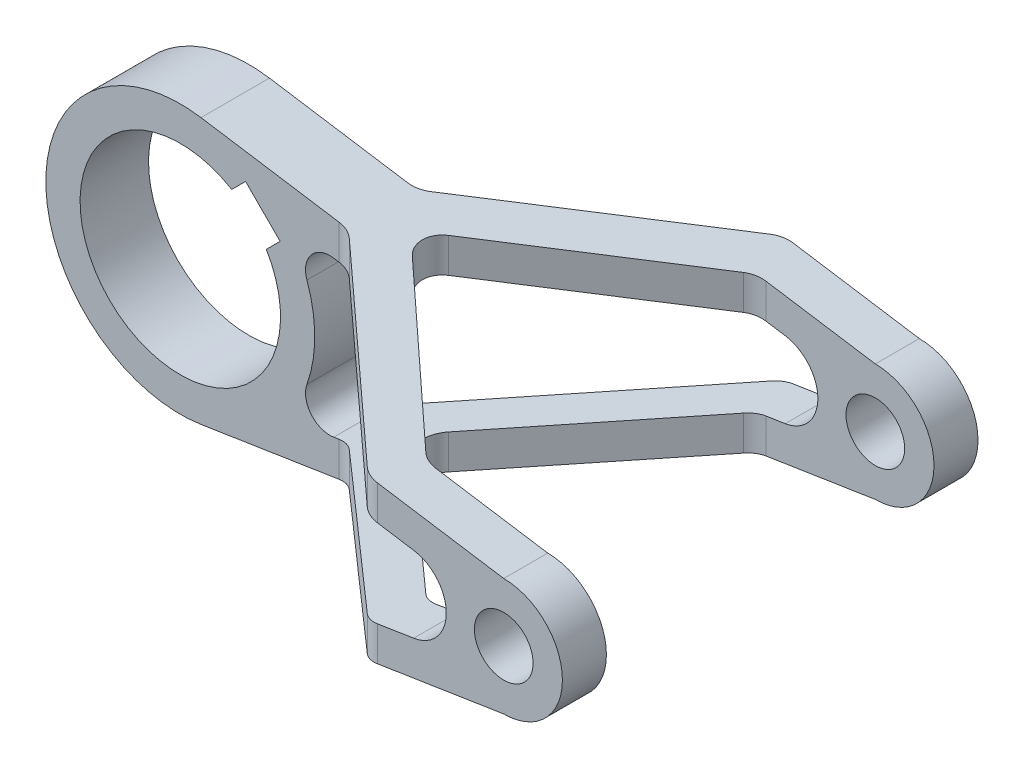
from build123d import *

# Parameters (mm, degrees)
Y_KSEKLIK_EKSTR_ZYON1_DEPTH = 55
KES_EKSTR_ZYON1_DEPTH       = 55
KES_EKSTR_ZYON1_DEPTH_BACK  = 55
IZIM4_R                     = 20.5
IZIM4_R_2                   = 6
KES_EKSTR_ZYON2_DEPTH       = 55
KES_EKSTR_ZYON2_DEPTH_BACK  = 55
KES_EKSTR_ZYON3_DEPTH       = 107.314994316
KES_EKSTR_ZYON3_DEPTH_BACK  = 107.314994316


with BuildPart() as part:
    # Çizim2 → Yükseklik-Ekstrüzyon1 (new body)
    with BuildSketch(Plane(origin=(0, 0, 0), x_dir=(1, 0, 0), z_dir=(0, 1, 0))):
        with BuildLine():
            Line((-60.70745329, -7), (-0.70745329, -7))
            ThreePointArc((-0.70745329, -7), (1.083042474, -7.331582183), (2.636059642, -8.282350033))
            Line((2.636059642, -8.282350033), (39.256799322, -41.217649967))
            ThreePointArc((39.256799322, -41.217649967), (40.809816489, -42.168417817), (42.600312254, -42.5))
            Line((42.600312254, -42.5), (80.446429482, -42.5))
            Line((80.446429482, -42.5), (80.446429482, -33.5))
            Line((80.446429482, -33.5), (45.577301243, -33.5))
            ThreePointArc((45.577301243, -33.5), (43.771367773, -33.162467619), (42.209258712, -32.19544172))
            Line((42.209258712, -32.19544172), (10.967785126, -3.72181941))
            ThreePointArc((10.967785126, -3.72181941), (9.335858983, -0.008678576), (10.994031787, 3.692815818))
            Line((10.994031787, 3.692815818), (42.741966981, 32.219193509))
            ThreePointArc((42.741966981, 32.219193509), (44.294345006, 33.168831093), (46.083762852, 33.5))
            Line((46.083762852, 33.5), (80.446429482, 33.5))
            Line((80.446429482, 33.5), (80.446429482, 42.5))
            Line((80.446429482, 42.5), (42.634342581, 42.5))
            ThreePointArc((42.634342581, 42.5), (40.844924735, 42.168831093), (39.29254671, 41.219193509))
            Line((39.29254671, 41.219193509), (2.634342581, 8.280806491))
            ThreePointArc((2.634342581, 8.280806491), (1.081964556, 7.331168907), (-0.70745329, 7))
            Line((-0.70745329, 7), (-60.70745329, 7))
            Line((-60.70745329, 7), (-60.70745329, -7))
        make_face()
    extrude(amount=Y_KSEKLIK_EKSTR_ZYON1_DEPTH)

    # Çizim4 → Kes-Ekstrüzyon1 (cut, two sides: drawn at the far end of the back side and taken through both)
    with BuildSketch(Plane.XY.offset(-KES_EKSTR_ZYON1_DEPTH_BACK)):
        with BuildLine():
            Line((-28.975635888, 54.672444157), (68.446429482, 39.5))
            ThreePointArc((68.446429482, 39.5), (76.931710856, 35.985281374), (80.446429482, 27.5))
            Line((80.446429482, 27.5), (80.446429482, 55))
            Line((80.446429482, 55), (-33.207453133, 55))
            ThreePointArc((-33.207453133, 55), (-31.085215516, 54.917988745), (-28.975635888, 54.672444157))
        make_face()
        with BuildLine():
            Line((80.446429482, 0), (80.446429482, 27.5))
            ThreePointArc((80.446429482, 27.5), (76.931710856, 19.014718626), (68.446429482, 15.5))
            Line((68.446429482, 15.5), (-28.975635888, 0.327555843))
            ThreePointArc((-28.975635888, 0.327555843), (-31.085215594, 0.082011249), (-33.20745329, 0))
            Line((-33.20745329, 0), (80.446429482, 0))
        make_face()
        with BuildLine():
            ThreePointArc((-60.70745329, 27.5), (-52.652889717, 46.945436538), (-33.207453133, 55))
            Line((-33.207453133, 55), (-60.70745329, 55))
            Line((-60.70745329, 55), (-60.70745329, 27.5))
        make_face()
        with BuildLine():
            ThreePointArc((-33.20745329, 0), (-52.652889773, 8.054563517), (-60.70745329, 27.5))
            Line((-60.70745329, 27.5), (-60.70745329, 0))
            Line((-60.70745329, 0), (-33.20745329, 0))
        make_face()
        with Locations(Location((-33.20745329, 27.5, 0), (0, 0, 180))):
            Circle(IZIM4_R)
        with Locations(Location((68.446429482, 27.5, 0), (0, 0, 180))):
            Circle(IZIM4_R_2)
    extrude(amount=KES_EKSTR_ZYON1_DEPTH + KES_EKSTR_ZYON1_DEPTH_BACK, mode=Mode.SUBTRACT)

    # Çizim7 → Kes-Ekstrüzyon2 (cut, two sides: drawn at the far end of the back side and taken through both)
    with BuildSketch(Plane.XY.offset(-KES_EKSTR_ZYON2_DEPTH_BACK)):
        with BuildLine():
            Line((-15.614003465, 38.022382014), (-12.78557634, 40.850809138))
            Line((-12.78557634, 40.850809138), (-19.856644152, 47.92187695))
            Line((-19.856644152, 47.92187695), (-22.685071277, 45.093449825))
            ThreePointArc((-22.685071277, 45.093449825), (-18.711764276, 41.995689014), (-15.614003465, 38.022382014))
        make_face()
    extrude(amount=KES_EKSTR_ZYON2_DEPTH + KES_EKSTR_ZYON2_DEPTH_BACK, mode=Mode.SUBTRACT)

    # Çizim8 → Kes-Ekstrüzyon3 (cut, two sides: drawn at the far end of the back side and taken through both)
    with BuildSketch(Plane.XY.offset(-KES_EKSTR_ZYON3_DEPTH_BACK)):
        with BuildLine():
            Line((-1.827361747, 11.63999197), (-1.784643175, 11.646644931))
            Line((-1.784643175, 11.646644931), (1.558869757, 12.16736129))
            Line((1.558869757, 12.16736129), (38.179609438, 17.870649613))
            Line((38.179609438, 17.870649613), (41.52312237, 18.391365973))
            Line((41.52312237, 18.391365973), (50.029447873, 19.716135143))
            ThreePointArc((50.029447873, 19.716135143), (56.694891282, 27.5), (50.029447873, 35.283864857))
            Line((50.029447873, 35.283864857), (41.52312237, 36.608634027))
            Line((41.52312237, 36.608634027), (38.179609438, 37.129350387))
            Line((38.179609438, 37.129350387), (1.558869757, 42.83263871))
            Line((1.558869757, 42.83263871), (-1.784643175, 43.353355069))
            Line((-1.784643175, 43.353355069), (-1.827361747, 43.36000803))
            ThreePointArc((-1.827361747, 43.36000803), (-6.448805477, 41.607340849), (-7.306116969, 36.73963077))
            ThreePointArc((-7.306116969, 36.73963077), (-5.70745329, 27.5), (-7.306116969, 18.26036923))
            ThreePointArc((-7.306116969, 18.26036923), (-6.448805477, 13.392659151), (-1.827361747, 11.63999197))
        make_face()
    extrude(amount=KES_EKSTR_ZYON3_DEPTH + KES_EKSTR_ZYON3_DEPTH_BACK, mode=Mode.SUBTRACT)


solid = part.part
